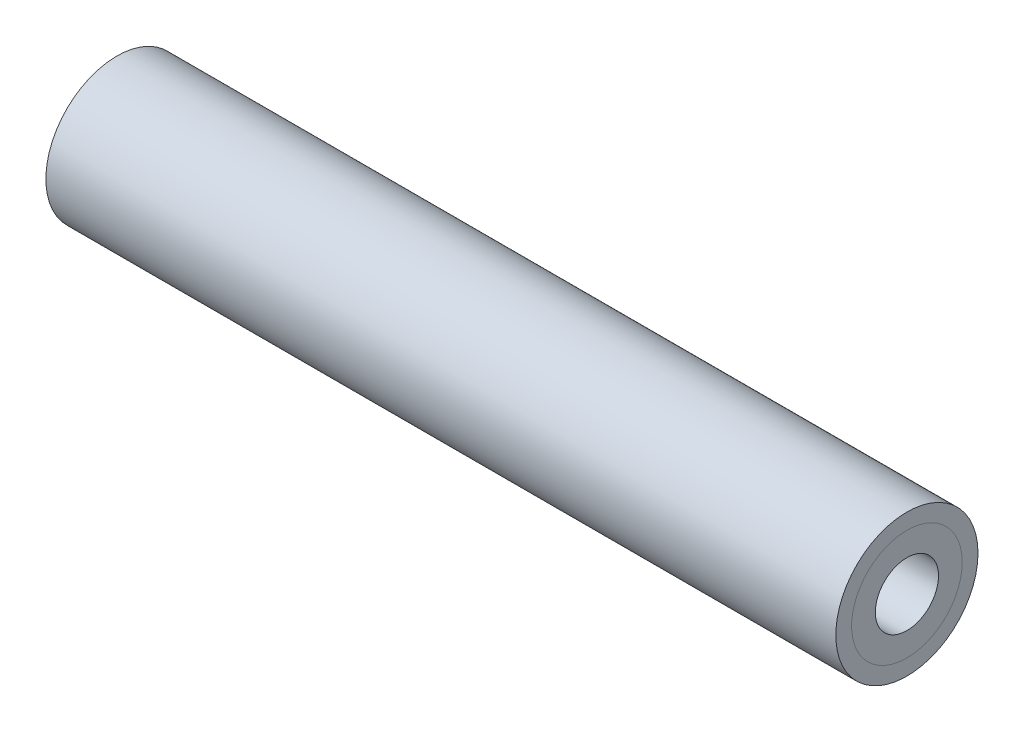
from build123d import *

# Parameters (mm, degrees)
SKETCH1_R           = 9
SKETCH1_R_2         = 7
BOSS_EXTRUDE1_DEPTH = 50
SKETCH3_R           = 7
SKETCH3_R_2         = 4
BOSS_EXTRUDE3_DEPTH = 15
BOSS_EXTRUDE4_START = -100
SKETCH3_2_R         = 7
SKETCH3_2_R_2       = 4
BOSS_EXTRUDE4_DEPTH = 15


with BuildPart() as part:
    # Sketch1 → Boss-Extrude1 (new, symmetric)
    with BuildSketch(Plane(origin=(0, 0, 0), x_dir=(0, 0, -1), z_dir=(1, 0, 0))):
        Circle(SKETCH1_R)
        Circle(SKETCH1_R_2, mode=Mode.SUBTRACT)
    extrude(amount=BOSS_EXTRUDE1_DEPTH, both=True)


with BuildPart() as body_2:
    # Sketch3 → Boss-Extrude3 (new body)
    with BuildSketch(Plane(origin=(50, 0, 0), x_dir=(0, 0, -1), z_dir=(1, 0, 0))):
        Circle(SKETCH3_R)
        Circle(SKETCH3_R_2, mode=Mode.SUBTRACT)
    extrude(amount=-BOSS_EXTRUDE3_DEPTH)


with BuildPart() as body_3:
    # Sketch3<2> → Boss-Extrude4 (new body)
    with BuildSketch(Plane(origin=(50, 0, 0), x_dir=(0, 0, -1), z_dir=(1, 0, 0)).offset(BOSS_EXTRUDE4_START)):
        Circle(SKETCH3_2_R)
        Circle(SKETCH3_2_R_2, mode=Mode.SUBTRACT)
    extrude(amount=BOSS_EXTRUDE4_DEPTH)


solid = Compound([part.part, body_2.part, body_3.part])
